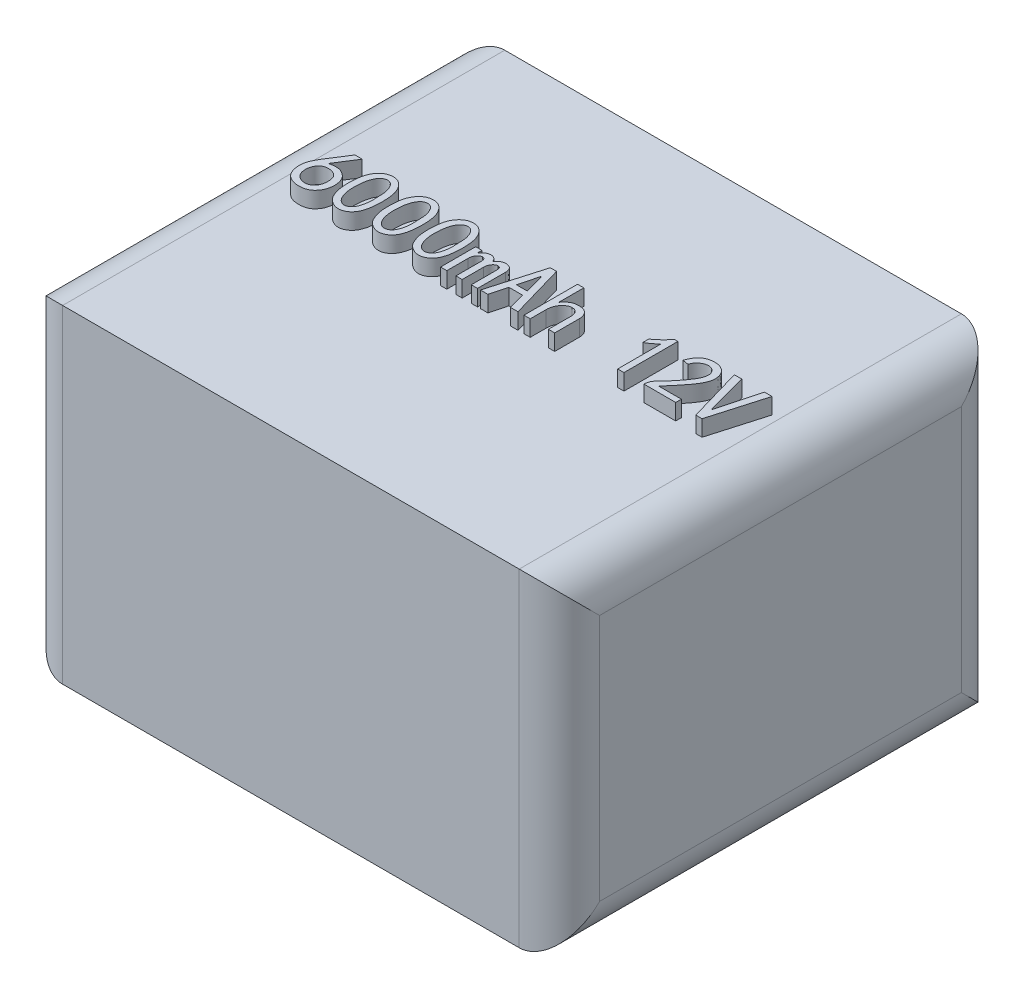
from build123d import *

# Parameters (mm, degrees)
SKETCH_1_W      = 66.8
SKETCH_1_H      = 55
EXTRUDE_1_DEPTH = 40.8
FILLET_1_R      = 5
EXTRUDE_2_DEPTH = 2


with BuildPart() as part:
    # 草图1 → 凸台-拉伸1 (new body)
    with BuildSketch(Plane(origin=(0, 0, 0), x_dir=(1, 0, 0), z_dir=(0, 1, 0))):
        with Locations((33.4, 27.5)):
            Rectangle(SKETCH_1_W, SKETCH_1_H)
    extrude(amount=EXTRUDE_1_DEPTH)

    # 圆角1
    fillet_1_edges = [part.edges().sort_by_distance(p)[0] for p in [
        (66.8, 40.8, -27.5),
        (0, 40.8, -27.5),
        (66.8, 0, -27.5),
        (0, 0, -27.5),
        (0, 20.4, -55),
        (66.8, 20.4, -55),
        (66.8, 20.4, 0),
        (0, 20.4, 0),
    ]]
    fillet(fillet_1_edges, radius=FILLET_1_R)

    # 草图3 → 凸台-拉伸2 (add)
    # profile 1 of 10: a face of its own
    with BuildSketch(Plane(origin=(0, 40.8, 0), x_dir=(1, 0, 0), z_dir=(0, 1, 0))):
        with BuildLine():
            add(Edge.make_bspline(
                [(11.582452743, 29.410355401), (11.586166957, 29.494181149), (11.593411207, 29.657675952), (11.614341343, 29.896069815), (11.639616615, 30.121689523), (11.672477807, 30.333845078), (11.713092583, 30.531830322), (11.759063521, 30.716682862), (11.812190182, 30.887885478), (11.890418071, 31.096974004), (12.007724524, 31.337632365), (12.17551857, 31.602133148), (12.370500827, 31.83990075), (12.554960243, 32.014120852), (12.714899037, 32.136737773), (12.842687085, 32.216348969), (12.976940509, 32.284370743), (13.11809958, 32.339843928), (13.265904721, 32.381166107), (13.419964352, 32.411673837), (13.580786928, 32.430546383), (13.746506674, 32.436161198), (13.913475146, 32.428299435), (14.077497758, 32.402688022), (14.235776716, 32.357221219), (14.388420095, 32.294802478), (14.535012479, 32.214602133), (14.67629178, 32.117264395), (14.81058309, 32.000271989), (14.939560133, 31.868375372), (15.060028466, 31.723212648), (15.170377192, 31.567585354), (15.270147919, 31.403098761), (15.358010789, 31.228850487), (15.436769418, 31.046377026), (15.502840905, 30.854053039), (15.557503666, 30.652659874), (15.617695927, 30.368156703), (15.670652066, 29.990770611), (15.707960335, 29.51314411), (15.71647351, 29.00386048), (15.703797245, 28.563434408), (15.679902191, 28.206587686), (15.652736156, 27.947762316), (15.616247461, 27.702126844), (15.573770277, 27.468485624), (15.52062875, 27.248081167), (15.457655471, 27.040677316), (15.389615667, 26.844919163), (15.309529144, 26.662864424), (15.222302353, 26.492967001), (15.122856353, 26.337403201), (15.015120496, 26.194071783), (14.896238839, 26.064108594), (14.764662525, 25.950131612), (14.624969299, 25.846641024), (14.473407586, 25.75855888), (14.314016088, 25.683812601), (14.149854846, 25.624324089), (13.982973327, 25.585551237), (13.816519664, 25.562506214), (13.649320878, 25.562421907), (13.482367588, 25.576959075), (13.316345433, 25.615199921), (13.149206573, 25.667776944), (12.985427889, 25.742130813), (12.827794772, 25.82774556), (12.679419983, 25.919892751), (12.544358408, 26.02016211), (12.42153089, 26.127241524), (12.309405193, 26.24023194), (12.209304568, 26.360206013), (12.122268009, 26.487495944), (12.025006237, 26.666639588), (11.920807817, 26.897713187), (11.812963032, 27.182340357), (11.724821117, 27.473813879), (11.668144071, 27.724292172), (11.630776974, 27.933836421), (11.61021753, 28.10561054), (11.592358561, 28.290518629), (11.581565112, 28.488603766), (11.574385651, 28.700037692), (11.571261028, 28.924971028), (11.57460539, 29.163377605), (11.579790778, 29.326576014), (11.582452743, 29.410355401)],
                knots=[0, 0, 0, 0, 1.18043416, 2.302333746, 3.366253517, 4.374302266, 5.321670991, 6.208995316, 7.053297808, 7.84229274, 9.348259463, 10.810477328, 12.240076564, 13.663562249, 14.3695339, 15.072606272, 15.778577923, 16.484387009, 17.202829605, 17.934942377, 18.692112664, 19.478485278, 20.265441384, 21.040673806, 21.808439453, 22.577161074, 23.356320991, 24.155029842, 24.986154494, 25.858111265, 26.748121484, 27.637306138, 28.540117759, 29.452135788, 30.380885827, 31.334339875, 32.310628684, 33.31521083, 35.42407972, 37.666773946, 40.052062172, 42.587025658, 43.863776122, 45.083322308, 46.247467896, 47.357025429, 48.423487632, 49.435172604, 50.405897663, 51.337337341, 52.231284254, 53.090220275, 53.931690991, 54.751583713, 55.562922169, 56.377338113, 57.194202079, 58.024663732, 58.851830165, 59.645552351, 60.431282623, 61.21044254, 61.99312915, 62.783838437, 63.60230231, 64.454612977, 65.309477934, 66.125301685, 66.909862715, 67.67340185, 68.415973016, 69.147238889, 69.868837108, 70.581506411, 72.0124375, 73.431838244, 74.861437481, 76.292961888, 77.042577341, 77.855187732, 78.726196438, 79.655959089, 80.645695907, 81.702690171, 82.820655125, 84, 84, 84, 84], degree=3))
        make_face()
        with BuildLine():
            add(Edge.make_bspline(
                [(12.401539305, 29.644380133), (12.392684128, 29.556316156), (12.375239122, 29.382827059), (12.360971218, 29.125459373), (12.356905251, 28.87537721), (12.360628569, 28.632479454), (12.374987458, 28.39724135), (12.399486149, 28.169207664), (12.434383806, 27.948538457), (12.477095455, 27.735818913), (12.528269894, 27.534448947), (12.588958673, 27.347164468), (12.658037112, 27.175329805), (12.734454099, 27.018686114), (12.818336594, 26.877046397), (12.911246582, 26.751214957), (13.010577381, 26.638514934), (13.119297521, 26.543803902), (13.230805841, 26.464267079), (13.344810676, 26.402467713), (13.45945268, 26.358676649), (13.575169416, 26.331900897), (13.691543793, 26.32335157), (13.808622211, 26.331632833), (13.925538636, 26.360536617), (14.041712329, 26.404835723), (14.153810223, 26.465849536), (14.259858752, 26.539524022), (14.357646773, 26.627507132), (14.447225988, 26.728854462), (14.528084162, 26.844192914), (14.602067943, 26.971550667), (14.667031324, 27.113040129), (14.743422668, 27.320205932), (14.820356046, 27.596095278), (14.888801583, 27.940842573), (14.929172439, 28.300369068), (14.939757254, 28.669243147), (14.932875016, 29.035765135), (14.924620637, 29.390823499), (14.904772683, 29.728418911), (14.881018622, 30.050270424), (14.840705762, 30.357815017), (14.76641453, 30.649441858), (14.662354326, 30.925941717), (14.555547801, 31.144210199), (14.453187433, 31.302648539), (14.372494355, 31.408956109), (14.282784238, 31.497788826), (14.188190124, 31.573519249), (14.086511533, 31.631174389), (13.978667996, 31.6743018), (13.864706605, 31.7010282), (13.746354409, 31.714206477), (13.62711863, 31.711902736), (13.510000311, 31.690974622), (13.396407403, 31.65437425), (13.285625158, 31.602269173), (13.179977891, 31.531746383), (13.077776888, 31.445433067), (12.980173521, 31.341875788), (12.88402792, 31.223885099), (12.796326402, 31.086874891), (12.715217994, 30.933397711), (12.643289933, 30.761481611), (12.578870916, 30.572121592), (12.521016428, 30.365327934), (12.472372443, 30.14097623), (12.432006531, 29.898887664), (12.41192654, 29.731149752), (12.401539305, 29.644380133)],
                knots=[0, 0, 0, 0, 1.378198314, 2.715098627, 4.012594964, 5.272602849, 6.497213731, 7.681415101, 8.842769074, 9.975170128, 11.059162755, 12.076494648, 13.038717388, 13.940857576, 14.788360499, 15.598271168, 16.373595835, 17.122768248, 17.838466736, 18.502782022, 19.136468245, 19.744060339, 20.345653328, 20.947246317, 21.563841626, 22.214212994, 22.87852828, 23.546305104, 24.220743313, 24.921956094, 25.648106704, 26.41081768, 27.212668989, 28.069279432, 29.84713992, 31.666334073, 33.537864714, 35.473745168, 37.408579624, 39.246547954, 41.003985019, 42.674193204, 44.272363647, 45.827394737, 47.348405091, 48.867584295, 49.599750274, 50.283750763, 50.94125936, 51.560811542, 52.165388272, 52.754418158, 53.363720025, 53.982318455, 54.604903792, 55.213928724, 55.828148287, 56.458765578, 57.113918044, 57.800421407, 58.537638978, 59.326979919, 60.167286366, 61.066273245, 62.027297208, 63.065989643, 64.179487018, 65.369443928, 66.639232213, 68, 68, 68, 68], degree=3))
        make_face(mode=Mode.SUBTRACT)
    # profile 2 of 10: a face of its own
    with BuildSketch(Plane(origin=(0, 40.8, 0), x_dir=(1, 0, 0), z_dir=(0, 1, 0))):
        with BuildLine():
            add(Edge.make_bspline(
                [(16.574980359, 29.410355401), (16.578694572, 29.494181149), (16.585938822, 29.657675952), (16.606868959, 29.896069815), (16.63214423, 30.121689523), (16.665005422, 30.333845078), (16.705620198, 30.531830322), (16.751591136, 30.716682862), (16.804717797, 30.887885478), (16.882945687, 31.096974004), (17.000252139, 31.337632365), (17.168046186, 31.602133148), (17.363028442, 31.83990075), (17.547487859, 32.014120852), (17.707426652, 32.136737773), (17.8352147, 32.216348969), (17.969468124, 32.284370743), (18.110627196, 32.339843928), (18.258432337, 32.381166107), (18.412491967, 32.411673837), (18.573314544, 32.430546383), (18.73903429, 32.436161198), (18.906002761, 32.428299435), (19.070025374, 32.402688022), (19.228304331, 32.357221219), (19.380947711, 32.294802478), (19.527540094, 32.214602133), (19.668819395, 32.117264395), (19.803110705, 32.000271989), (19.932087748, 31.868375372), (20.052556082, 31.723212648), (20.162904807, 31.567585354), (20.262675535, 31.403098761), (20.350538404, 31.228850487), (20.429297033, 31.046377026), (20.49536852, 30.854053039), (20.550031281, 30.652659874), (20.610223542, 30.368156703), (20.663179682, 29.990770611), (20.70048795, 29.51314411), (20.709001126, 29.00386048), (20.69632486, 28.563434408), (20.672429806, 28.206587686), (20.645263772, 27.947762316), (20.608775076, 27.702126844), (20.566297893, 27.468485624), (20.513156365, 27.248081167), (20.450183086, 27.040677316), (20.382143282, 26.844919163), (20.302056759, 26.662864424), (20.214829968, 26.492967001), (20.115383969, 26.337403201), (20.007648111, 26.194071783), (19.888766455, 26.064108594), (19.757190141, 25.950131612), (19.617496914, 25.846641024), (19.465935201, 25.75855888), (19.306543704, 25.683812601), (19.142382461, 25.624324089), (18.975500942, 25.585551237), (18.80904728, 25.562506214), (18.641848494, 25.562421907), (18.474895203, 25.576959075), (18.308873048, 25.615199921), (18.141734188, 25.667776944), (17.977955504, 25.742130813), (17.820322387, 25.82774556), (17.671947598, 25.919892751), (17.536886023, 26.02016211), (17.414058505, 26.127241524), (17.301932808, 26.24023194), (17.201832183, 26.360206013), (17.114795624, 26.487495944), (17.017533853, 26.666639588), (16.913335433, 26.897713187), (16.805490648, 27.182340357), (16.717348732, 27.473813879), (16.660671687, 27.724292172), (16.623304589, 27.933836421), (16.602745145, 28.10561054), (16.584886176, 28.290518629), (16.574092727, 28.488603766), (16.566913266, 28.700037692), (16.563788644, 28.924971028), (16.567133006, 29.163377605), (16.572318393, 29.326576014), (16.574980359, 29.410355401)],
                knots=[0, 0, 0, 0, 1.18043416, 2.302333746, 3.366253517, 4.374302266, 5.321670991, 6.208995316, 7.053297808, 7.84229274, 9.348259463, 10.810477328, 12.240076564, 13.663562249, 14.3695339, 15.072606272, 15.778577923, 16.484387009, 17.202829605, 17.934942377, 18.692112664, 19.478485278, 20.265441384, 21.040673806, 21.808439453, 22.577161074, 23.356320991, 24.155029842, 24.986154494, 25.858111265, 26.748121484, 27.637306138, 28.540117759, 29.452135788, 30.380885827, 31.334339875, 32.310628684, 33.31521083, 35.42407972, 37.666773946, 40.052062172, 42.587025658, 43.863776122, 45.083322308, 46.247467896, 47.357025429, 48.423487632, 49.435172604, 50.405897663, 51.337337341, 52.231284254, 53.090220275, 53.931690991, 54.751583713, 55.562922169, 56.377338113, 57.194202079, 58.024663732, 58.851830165, 59.645552351, 60.431282623, 61.21044254, 61.99312915, 62.783838437, 63.60230231, 64.454612977, 65.309477934, 66.125301685, 66.909862715, 67.67340185, 68.415973016, 69.147238889, 69.868837108, 70.581506411, 72.0124375, 73.431838244, 74.861437481, 76.292961888, 77.042577341, 77.855187732, 78.726196438, 79.655959089, 80.645695907, 81.702690171, 82.820655125, 84, 84, 84, 84], degree=3))
        make_face()
        with BuildLine():
            add(Edge.make_bspline(
                [(17.39406692, 29.644380133), (17.385211744, 29.556316156), (17.367766737, 29.382827059), (17.353498833, 29.125459373), (17.349432866, 28.87537721), (17.353156185, 28.632479454), (17.367515074, 28.39724135), (17.392013765, 28.169207664), (17.426911422, 27.948538457), (17.469623071, 27.735818913), (17.52079751, 27.534448947), (17.581486289, 27.347164468), (17.650564728, 27.175329805), (17.726981714, 27.018686114), (17.810864209, 26.877046397), (17.903774198, 26.751214957), (18.003104997, 26.638514934), (18.111825136, 26.543803902), (18.223333456, 26.464267079), (18.337338292, 26.402467713), (18.451980295, 26.358676649), (18.567697031, 26.331900897), (18.684071408, 26.32335157), (18.801149827, 26.331632833), (18.918066252, 26.360536617), (19.034239944, 26.404835723), (19.146337838, 26.465849536), (19.252386367, 26.539524022), (19.350174389, 26.627507132), (19.439753603, 26.728854462), (19.520611778, 26.844192914), (19.594595558, 26.971550667), (19.65955894, 27.113040129), (19.735950284, 27.320205932), (19.812883661, 27.596095278), (19.881329199, 27.940842573), (19.921700054, 28.300369068), (19.93228487, 28.669243147), (19.925402631, 29.035765135), (19.917148253, 29.390823499), (19.897300298, 29.728418911), (19.873546237, 30.050270424), (19.833233377, 30.357815017), (19.758942146, 30.649441858), (19.654881941, 30.925941717), (19.548075417, 31.144210199), (19.445715049, 31.302648539), (19.36502197, 31.408956109), (19.275311854, 31.497788826), (19.180717739, 31.573519249), (19.079039148, 31.631174389), (18.971195611, 31.6743018), (18.85723422, 31.7010282), (18.738882024, 31.714206477), (18.619646245, 31.711902736), (18.502527926, 31.690974622), (18.388935018, 31.65437425), (18.278152773, 31.602269173), (18.172505506, 31.531746383), (18.070304503, 31.445433067), (17.972701136, 31.341875788), (17.876555536, 31.223885099), (17.788854017, 31.086874891), (17.70774561, 30.933397711), (17.635817548, 30.761481611), (17.571398531, 30.572121592), (17.513544044, 30.365327934), (17.464900059, 30.14097623), (17.424534146, 29.898887664), (17.404454156, 29.731149752), (17.39406692, 29.644380133)],
                knots=[0, 0, 0, 0, 1.378198314, 2.715098627, 4.012594964, 5.272602849, 6.497213731, 7.681415101, 8.842769074, 9.975170128, 11.059162755, 12.076494648, 13.038717388, 13.940857576, 14.788360499, 15.598271168, 16.373595835, 17.122768248, 17.838466736, 18.502782022, 19.136468245, 19.744060339, 20.345653328, 20.947246317, 21.563841626, 22.214212994, 22.87852828, 23.546305104, 24.220743313, 24.921956094, 25.648106704, 26.41081768, 27.212668989, 28.069279432, 29.84713992, 31.666334073, 33.537864714, 35.473745168, 37.408579624, 39.246547954, 41.003985019, 42.674193204, 44.272363647, 45.827394737, 47.348405091, 48.867584295, 49.599750274, 50.283750763, 50.94125936, 51.560811542, 52.165388272, 52.754418158, 53.363720025, 53.982318455, 54.604903792, 55.213928724, 55.828148287, 56.458765578, 57.113918044, 57.800421407, 58.537638978, 59.326979919, 60.167286366, 61.066273245, 62.027297208, 63.065989643, 64.179487018, 65.369443928, 66.639232213, 68, 68, 68, 68], degree=3))
        make_face(mode=Mode.SUBTRACT)
    # profile 3 of 10: a face of its own
    with BuildSketch(Plane(origin=(0, 40.8, 0), x_dir=(1, 0, 0), z_dir=(0, 1, 0))):
        with BuildLine():
            add(Edge.make_bspline(
                [(21.567507974, 29.410355401), (21.571222188, 29.494181149), (21.578466438, 29.657675952), (21.599396574, 29.896069815), (21.624671845, 30.121689523), (21.657533038, 30.333845078), (21.698147813, 30.531830322), (21.744118752, 30.716682862), (21.797245413, 30.887885478), (21.875473302, 31.096974004), (21.992779754, 31.337632365), (22.160573801, 31.602133148), (22.355556057, 31.83990075), (22.540015474, 32.014120852), (22.699954268, 32.136737773), (22.827742316, 32.216348969), (22.961995739, 32.284370743), (23.103154811, 32.339843928), (23.250959952, 32.381166107), (23.405019582, 32.411673837), (23.565842159, 32.430546383), (23.731561905, 32.436161198), (23.898530377, 32.428299435), (24.062552989, 32.402688022), (24.220831947, 32.357221219), (24.373475326, 32.294802478), (24.520067709, 32.214602133), (24.66134701, 32.117264395), (24.79563832, 32.000271989), (24.924615364, 31.868375372), (25.045083697, 31.723212648), (25.155432423, 31.567585354), (25.25520315, 31.403098761), (25.343066019, 31.228850487), (25.421824648, 31.046377026), (25.487896135, 30.854053039), (25.542558897, 30.652659874), (25.602751157, 30.368156703), (25.655707297, 29.990770611), (25.693015566, 29.51314411), (25.701528741, 29.00386048), (25.688852475, 28.563434408), (25.664957421, 28.206587686), (25.637791387, 27.947762316), (25.601302692, 27.702126844), (25.558825508, 27.468485624), (25.505683981, 27.248081167), (25.442710702, 27.040677316), (25.374670898, 26.844919163), (25.294584375, 26.662864424), (25.207357583, 26.492967001), (25.107911584, 26.337403201), (25.000175726, 26.194071783), (24.88129407, 26.064108594), (24.749717756, 25.950131612), (24.61002453, 25.846641024), (24.458462817, 25.75855888), (24.299071319, 25.683812601), (24.134910077, 25.624324089), (23.968028557, 25.585551237), (23.801574895, 25.562506214), (23.634376109, 25.562421907), (23.467422818, 25.576959075), (23.301400664, 25.615199921), (23.134261804, 25.667776944), (22.97048312, 25.742130813), (22.812850002, 25.82774556), (22.664475214, 25.919892751), (22.529413639, 26.02016211), (22.40658612, 26.127241524), (22.294460423, 26.24023194), (22.194359799, 26.360206013), (22.107323239, 26.487495944), (22.010061468, 26.666639588), (21.905863048, 26.897713187), (21.798018263, 27.182340357), (21.709876348, 27.473813879), (21.653199302, 27.724292172), (21.615832205, 27.933836421), (21.59527276, 28.10561054), (21.577413791, 28.290518629), (21.566620342, 28.488603766), (21.559440881, 28.700037692), (21.556316259, 28.924971028), (21.559660621, 29.163377605), (21.564846008, 29.326576014), (21.567507974, 29.410355401)],
                knots=[0, 0, 0, 0, 1.18043416, 2.302333746, 3.366253517, 4.374302266, 5.321670991, 6.208995316, 7.053297808, 7.84229274, 9.348259463, 10.810477328, 12.240076564, 13.663562249, 14.3695339, 15.072606272, 15.778577923, 16.484387009, 17.202829605, 17.934942377, 18.692112664, 19.478485278, 20.265441384, 21.040673806, 21.808439453, 22.577161074, 23.356320991, 24.155029842, 24.986154494, 25.858111265, 26.748121484, 27.637306138, 28.540117759, 29.452135788, 30.380885827, 31.334339875, 32.310628684, 33.31521083, 35.42407972, 37.666773946, 40.052062172, 42.587025658, 43.863776122, 45.083322308, 46.247467896, 47.357025429, 48.423487632, 49.435172604, 50.405897663, 51.337337341, 52.231284254, 53.090220275, 53.931690991, 54.751583713, 55.562922169, 56.377338113, 57.194202079, 58.024663732, 58.851830165, 59.645552351, 60.431282623, 61.21044254, 61.99312915, 62.783838437, 63.60230231, 64.454612977, 65.309477934, 66.125301685, 66.909862715, 67.67340185, 68.415973016, 69.147238889, 69.868837108, 70.581506411, 72.0124375, 73.431838244, 74.861437481, 76.292961888, 77.042577341, 77.855187732, 78.726196438, 79.655959089, 80.645695907, 81.702690171, 82.820655125, 84, 84, 84, 84], degree=3))
        make_face()
        with BuildLine():
            add(Edge.make_bspline(
                [(22.386594536, 29.644380133), (22.377739359, 29.556316156), (22.360294353, 29.382827059), (22.346026449, 29.125459373), (22.341960482, 28.87537721), (22.3456838, 28.632479454), (22.360042689, 28.39724135), (22.38454138, 28.169207664), (22.419439037, 27.948538457), (22.462150686, 27.735818913), (22.513325125, 27.534448947), (22.574013904, 27.347164468), (22.643092343, 27.175329805), (22.71950933, 27.018686114), (22.803391824, 26.877046397), (22.896301813, 26.751214957), (22.995632612, 26.638514934), (23.104352751, 26.543803902), (23.215861072, 26.464267079), (23.329865907, 26.402467713), (23.444507911, 26.358676649), (23.560224647, 26.331900897), (23.676599024, 26.32335157), (23.793677442, 26.331632833), (23.910593867, 26.360536617), (24.02676756, 26.404835723), (24.138865453, 26.465849536), (24.244913983, 26.539524022), (24.342702004, 26.627507132), (24.432281218, 26.728854462), (24.513139393, 26.844192914), (24.587123173, 26.971550667), (24.652086555, 27.113040129), (24.728477899, 27.320205932), (24.805411277, 27.596095278), (24.873856814, 27.940842573), (24.914227669, 28.300369068), (24.924812485, 28.669243147), (24.917930246, 29.035765135), (24.909675868, 29.390823499), (24.889827913, 29.728418911), (24.866073853, 30.050270424), (24.825760993, 30.357815017), (24.751469761, 30.649441858), (24.647409556, 30.925941717), (24.540603032, 31.144210199), (24.438242664, 31.302648539), (24.357549586, 31.408956109), (24.267839469, 31.497788826), (24.173245355, 31.573519249), (24.071566764, 31.631174389), (23.963723226, 31.6743018), (23.849761835, 31.7010282), (23.731409639, 31.714206477), (23.61217386, 31.711902736), (23.495055542, 31.690974622), (23.381462634, 31.65437425), (23.270680389, 31.602269173), (23.165033121, 31.531746383), (23.062832118, 31.445433067), (22.965228751, 31.341875788), (22.869083151, 31.223885099), (22.781381632, 31.086874891), (22.700273225, 30.933397711), (22.628345164, 30.761481611), (22.563926147, 30.572121592), (22.506071659, 30.365327934), (22.457427674, 30.14097623), (22.417061761, 29.898887664), (22.396981771, 29.731149752), (22.386594536, 29.644380133)],
                knots=[0, 0, 0, 0, 1.378198314, 2.715098627, 4.012594964, 5.272602849, 6.497213731, 7.681415101, 8.842769074, 9.975170128, 11.059162755, 12.076494648, 13.038717388, 13.940857576, 14.788360499, 15.598271168, 16.373595835, 17.122768248, 17.838466736, 18.502782022, 19.136468245, 19.744060339, 20.345653328, 20.947246317, 21.563841626, 22.214212994, 22.87852828, 23.546305104, 24.220743313, 24.921956094, 25.648106704, 26.41081768, 27.212668989, 28.069279432, 29.84713992, 31.666334073, 33.537864714, 35.473745168, 37.408579624, 39.246547954, 41.003985019, 42.674193204, 44.272363647, 45.827394737, 47.348405091, 48.867584295, 49.599750274, 50.283750763, 50.94125936, 51.560811542, 52.165388272, 52.754418158, 53.363720025, 53.982318455, 54.604903792, 55.213928724, 55.828148287, 56.458765578, 57.113918044, 57.800421407, 58.537638978, 59.326979919, 60.167286366, 61.066273245, 62.027297208, 63.065989643, 64.179487018, 65.369443928, 66.639232213, 68, 68, 68, 68], degree=3))
        make_face(mode=Mode.SUBTRACT)
    # profile 4 of 10: a face of its own
    with BuildSketch(Plane(origin=(0, 40.8, 0), x_dir=(1, 0, 0), z_dir=(0, 1, 0))):
        with BuildLine():
            add(Edge.make_bspline(
                [(6.62892925, 27.967202887), (6.636441563, 28.057943651), (6.650987535, 28.23364355), (6.69858255, 28.483934061), (6.75751293, 28.714051224), (6.840650869, 28.927467443), (6.947064026, 29.139826755), (7.06540603, 29.372850516), (7.209789983, 29.628169017), (7.314784779, 29.805408702), (7.370007568, 29.898629224)],
                knots=[0, 0, 0, 0, 1.042998706, 2.019541814, 2.916615498, 3.762308625, 4.638715294, 5.638536551, 6.75797084, 8, 8, 8, 8], degree=3))
            Line((7.370007568, 29.898629224), (8.96917657, 32.394893032))
            Line((8.96917657, 32.394893032), (9.866271375, 32.394893032))
            Line((9.866271375, 32.394893032), (8.228098252, 29.82062098))
            add(Edge.make_bspline(
                [(8.228098252, 29.82062098), (8.313553702, 29.841564003), (8.47861427, 29.882016277), (8.722491257, 29.921252324), (8.952897209, 29.940440336), (9.16990058, 29.940991764), (9.373809893, 29.923041589), (9.564422025, 29.884186203), (9.741999901, 29.824913342), (9.904854661, 29.745946578), (10.053363957, 29.656239862), (10.19005944, 29.563260132), (10.314593964, 29.468403026), (10.426124042, 29.369964842), (10.525672257, 29.268852113), (10.609974919, 29.162687783), (10.685910213, 29.056237357), (10.762630686, 28.90670107), (10.843180348, 28.71480305), (10.913578186, 28.474349878), (10.960261855, 28.224126134), (10.98065355, 27.966685038), (10.980483371, 27.705469297), (10.951723176, 27.444972855), (10.901846583, 27.186363047), (10.824956104, 26.932121649), (10.722265967, 26.6828117), (10.581334347, 26.445803664), (10.406551657, 26.220832354), (10.234870298, 26.047071324), (10.081696716, 25.917135096), (9.951157193, 25.833728716), (9.811188446, 25.75982583), (9.659773657, 25.697600742), (9.497948831, 25.646854081), (9.324605897, 25.610227911), (9.140872224, 25.582356417), (8.948758827, 25.567518223), (8.755293838, 25.562313509), (8.566242453, 25.571918288), (8.384226391, 25.589847713), (8.209428363, 25.62013899), (8.041618502, 25.661928738), (7.882068014, 25.717037016), (7.728852412, 25.782401345), (7.583784556, 25.858450874), (7.447382144, 25.944703296), (7.323497449, 26.042512148), (7.2082574, 26.146079941), (7.105509484, 26.259894351), (7.012313578, 26.381122381), (6.932035103, 26.512013111), (6.859713222, 26.649865221), (6.783539861, 26.844839246), (6.709070798, 27.092096012), (6.649666006, 27.388575078), (6.617470406, 27.680067964), (6.625141483, 27.872289284), (6.62892925, 27.967202887)],
                knots=[0, 0, 0, 0, 1.30987361, 2.530072464, 3.674076933, 4.749737101, 5.758005553, 6.717161001, 7.640113921, 8.538216801, 9.406478839, 10.221965151, 10.999356528, 11.736024514, 12.43585607, 13.108943968, 13.753423114, 14.378993464, 15.606901413, 16.848076322, 18.102664827, 19.390785032, 20.688768111, 21.98673138, 23.287623163, 24.605715361, 25.936233508, 27.292778926, 28.698472844, 30.169013905, 30.922829238, 31.684618084, 32.470496446, 33.277520399, 34.118983406, 34.992471271, 35.913332431, 36.884634966, 37.860137434, 38.793368636, 39.701719614, 40.582389804, 41.432879653, 42.274220425, 43.093418803, 43.911360741, 44.711055379, 45.492833336, 46.259332936, 47.015702139, 47.772988627, 48.533121813, 49.299654956, 50.087983324, 51.646482558, 53.138633408, 54.587135849, 56, 56, 56, 56], degree=3))
        make_face()
        with BuildLine():
            add(Edge.make_bspline(
                [(7.838057032, 26.680066861), (7.867826536, 26.650545451), (7.927577179, 26.591292761), (8.027091567, 26.514127941), (8.133812722, 26.446426519), (8.248030944, 26.390932856), (8.368868862, 26.343283116), (8.497746181, 26.310318436), (8.633044362, 26.282845766), (8.773818223, 26.269873834), (8.915550254, 26.265083799), (9.053391514, 26.27937867), (9.185760455, 26.303909285), (9.311399407, 26.347337617), (9.431480163, 26.40323042), (9.545036052, 26.474600974), (9.65106772, 26.561538459), (9.751985138, 26.660062765), (9.843361493, 26.773349283), (9.923017207, 26.899999882), (9.990896664, 27.038943647), (10.045820611, 27.190065295), (10.087194111, 27.352798843), (10.11739281, 27.527151084), (10.136185163, 27.713961197), (10.141145889, 27.908475718), (10.135285129, 28.101695924), (10.113117925, 28.283847454), (10.073383761, 28.449511744), (10.022419167, 28.600894627), (9.952887587, 28.735531246), (9.867736661, 28.854713738), (9.768010996, 28.958333462), (9.652010351, 29.042933144), (9.528780575, 29.114089228), (9.400950157, 29.173557594), (9.270073926, 29.221665683), (9.135327088, 29.258169459), (8.99595916, 29.28129955), (8.852807227, 29.290902256), (8.706464328, 29.289365104), (8.559060091, 29.276662912), (8.414439472, 29.251974105), (8.278642788, 29.211033749), (8.152194653, 29.158860987), (8.035940669, 29.092712868), (7.931893854, 29.010455346), (7.836308495, 28.917374461), (7.752575637, 28.809528315), (7.655813418, 28.649963045), (7.560056062, 28.43662439), (7.480285636, 28.169449456), (7.441353119, 27.894408789), (7.441809451, 27.66230323), (7.460332113, 27.479115316), (7.484864701, 27.346666653), (7.519954475, 27.220806274), (7.562958781, 27.100137929), (7.616690127, 26.98551826), (7.680612838, 26.876809276), (7.753825994, 26.7739901), (7.81000274, 26.711349272), (7.838057032, 26.680066861)],
                knots=[0, 0, 0, 0, 0.824379014, 1.654618615, 2.472217002, 3.307040171, 4.149944448, 5.023399345, 5.920986251, 6.863846236, 7.802124107, 8.706338671, 9.585327007, 10.445314643, 11.314286422, 12.187124327, 13.076521263, 14.007883694, 14.9579535, 15.93325223, 16.946080417, 17.995267438, 19.091535754, 20.245890406, 21.474436714, 22.782621587, 24.072176649, 25.275692408, 26.385796877, 27.419682211, 28.411368294, 29.355370333, 30.293504652, 31.227802789, 32.170424673, 33.090341057, 33.998667172, 34.911184711, 35.833391934, 36.773820451, 37.730905064, 38.710612777, 39.6827302, 40.612114241, 41.495534864, 42.369965774, 43.234275376, 44.098636918, 44.989546864, 45.912629924, 47.765713501, 49.573670898, 51.382745352, 53.211540175, 54.12612168, 55.003320594, 55.858492095, 56.694765964, 57.521374723, 58.34531796, 59.173662839, 60, 60, 60, 60], degree=3))
        make_face(mode=Mode.SUBTRACT)
    # profile 5 of 10: a face of its own
    with BuildSketch(Plane(origin=(0, 40.8, 0), x_dir=(1, 0, 0), z_dir=(0, 1, 0))):
        with BuildLine():
            Line((30.967501375, 25.647179927), (30.187418935, 25.647179927))
            Line((30.187418935, 25.647179927), (30.187418935, 28.806513808))
            add(Edge.make_bspline(
                [(30.187418935, 28.806513808), (30.186765559, 28.844120179), (30.185512019, 28.916270311), (30.171103668, 29.019577344), (30.146528735, 29.112769722), (30.113259661, 29.196332239), (30.063831555, 29.267843244), (29.991773376, 29.31922202), (29.899994175, 29.347483624), (29.833211929, 29.350794797), (29.797377715, 29.352571516)],
                knots=[0, 0, 0, 0, 1.172990478, 2.250454306, 3.245547364, 4.174930135, 5.046638938, 5.918347741, 6.883020922, 8, 8, 8, 8], degree=3))
            add(Edge.make_bspline(
                [(29.797377715, 29.352571516), (29.752021073, 29.34882655), (29.659922169, 29.34122221), (29.527403324, 29.280865253), (29.40137426, 29.186876), (29.284038299, 29.059127265), (29.181275527, 28.903752032), (29.109085749, 28.720796259), (29.063310236, 28.517443597), (29.058692866, 28.373878766), (29.056299397, 28.299460222)],
                knots=[0, 0, 0, 0, 0.766913604, 1.557256011, 2.427911044, 3.421802423, 4.484200412, 5.568564768, 6.739636535, 8, 8, 8, 8], degree=3))
            Line((29.056299397, 28.299460222), (29.056299397, 25.647179927))
            Line((29.056299397, 25.647179927), (28.276216957, 25.647179927))
            Line((28.276216957, 25.647179927), (28.276216957, 28.806513808))
            add(Edge.make_bspline(
                [(28.276216957, 28.806513808), (28.275563582, 28.844120179), (28.274310041, 28.916270311), (28.25990169, 29.019577344), (28.235326757, 29.112769722), (28.202057684, 29.196332239), (28.152629577, 29.267843244), (28.080571398, 29.31922202), (27.988792198, 29.347483624), (27.922009951, 29.350794797), (27.886175737, 29.352571516)],
                knots=[0, 0, 0, 0, 1.172990478, 2.250454306, 3.245547364, 4.174930135, 5.046638938, 5.918347741, 6.883020922, 8, 8, 8, 8], degree=3))
            add(Edge.make_bspline(
                [(27.886175737, 29.352571516), (27.840819096, 29.34882655), (27.748720192, 29.34122221), (27.616201347, 29.280865253), (27.490172282, 29.186876), (27.372836321, 29.059127265), (27.270073549, 28.903752032), (27.197883771, 28.720796259), (27.152108258, 28.517443597), (27.147490888, 28.373878766), (27.145097419, 28.299460222)],
                knots=[0, 0, 0, 0, 0.766913604, 1.557256011, 2.427911044, 3.421802423, 4.484200412, 5.568564768, 6.739636535, 8, 8, 8, 8], degree=3))
            Line((27.145097419, 28.299460222), (27.145097419, 25.647179927))
            Line((27.145097419, 25.647179927), (26.365014979, 25.647179927))
            Line((26.365014979, 25.647179927), (26.365014979, 30.01564159))
            Line((26.365014979, 30.01564159), (27.145097419, 30.01564159))
            Line((27.145097419, 30.01564159), (27.145097419, 29.43057976))
            add(Edge.make_bspline(
                [(27.145097419, 29.43057976), (27.178164455, 29.480538569), (27.242919918, 29.578373335), (27.357377627, 29.708277355), (27.478121937, 29.824110096), (27.610358711, 29.919384278), (27.749356457, 29.996466433), (27.894038143, 30.054223364), (28.045139571, 30.086226792), (28.147028686, 30.091167874), (28.198208713, 30.093649834)],
                knots=[0, 0, 0, 0, 1.105035383, 2.164000341, 3.189319476, 4.188868779, 5.163914028, 6.118307184, 7.054804926, 8, 8, 8, 8], degree=3))
            add(Edge.make_bspline(
                [(28.198208713, 30.093649834), (28.248439929, 30.091303428), (28.345630992, 30.086763429), (28.486224516, 30.05517658), (28.612947584, 29.997666526), (28.726624229, 29.919827337), (28.827980066, 29.824817032), (28.908195845, 29.707939962), (28.975314379, 29.576705252), (29.003009258, 29.480305978), (29.017295275, 29.43057976)],
                knots=[0, 0, 0, 0, 1.054125019, 2.039598852, 3.00311637, 3.956135942, 4.921083366, 5.899693326, 6.916586166, 8, 8, 8, 8], degree=3))
            add(Edge.make_bspline(
                [(29.017295275, 29.43057976), (29.050028308, 29.480405634), (29.113759789, 29.577417015), (29.223491678, 29.707875789), (29.338398561, 29.82293305), (29.462236251, 29.9197266), (29.594010192, 29.996193292), (29.732634382, 30.054961888), (29.880268991, 30.08621425), (29.980713988, 30.091156023), (30.031402447, 30.093649834)],
                knots=[0, 0, 0, 0, 1.127724244, 2.195688248, 3.220611048, 4.201621127, 5.161610027, 6.097757614, 7.040054382, 8, 8, 8, 8], degree=3))
            add(Edge.make_bspline(
                [(30.031402447, 30.093649834), (30.104883796, 30.090980613), (30.243970255, 30.085928277), (30.438355872, 30.038335122), (30.604150204, 29.958152549), (30.738983529, 29.843747748), (30.842934462, 29.700046894), (30.91745597, 29.52981864), (30.960337386, 29.332514665), (30.965027269, 29.192441263), (30.967501375, 29.118546784)],
                knots=[0, 0, 0, 0, 1.141342915, 2.160348787, 3.088109297, 3.980870533, 4.881139354, 5.823297628, 6.851700002, 8, 8, 8, 8], degree=3))
            Line((30.967501375, 29.118546784), (30.967501375, 25.647179927))
        make_face()
    # profile 6 of 10: a face of its own
    with BuildSketch(Plane(origin=(0, 40.8, 0), x_dir=(1, 0, 0), z_dir=(0, 1, 0))):
        Polygon((35.999033112, 25.647179927), (35.062934184, 25.647179927), (34.516876476, 27.714398393), (32.800695108, 27.714398393), (32.2546374, 25.647179927), (31.318538473, 25.647179927), (33.268744572, 32.394893032), (34.048827012, 32.394893032), align=None)
        Polygon((34.321855866, 28.45547671), (33.697789914, 30.834728152), (33.61978167, 30.834728152), (32.995715718, 28.45547671), align=None, mode=Mode.SUBTRACT)
    # profile 7 of 10: a face of its own
    with BuildSketch(Plane(origin=(0, 40.8, 0), x_dir=(1, 0, 0), z_dir=(0, 1, 0))):
        with BuildLine():
            Line((40.562515385, 25.647179927), (39.782432945, 25.647179927))
            Line((39.782432945, 25.647179927), (39.782432945, 28.45547671))
            add(Edge.make_bspline(
                [(39.782432945, 28.45547671), (39.779973222, 28.529865065), (39.775293728, 28.671384964), (39.731600177, 28.872111658), (39.657792548, 29.048538544), (39.554429126, 29.199019829), (39.426859575, 29.320637977), (39.276716453, 29.408469369), (39.106305714, 29.460202088), (38.986339478, 29.466387388), (38.924342262, 29.469583882)],
                knots=[0, 0, 0, 0, 1.191937445, 2.267597745, 3.274659925, 4.240880371, 5.175179059, 6.078607681, 7.007045828, 8, 8, 8, 8], degree=3))
            add(Edge.make_bspline(
                [(38.924342262, 29.469583882), (38.882326525, 29.467821798), (38.798074639, 29.464288384), (38.672937978, 29.438392167), (38.549337336, 29.398274129), (38.428270695, 29.339314851), (38.310265269, 29.26317327), (38.192099349, 29.173197006), (38.076537512, 29.065786423), (37.965675168, 28.942450575), (37.86075518, 28.808806085), (37.769003096, 28.664790395), (37.69242851, 28.512695719), (37.630009652, 28.352455992), (37.581317164, 28.184627113), (37.544275406, 28.009033304), (37.524716429, 27.825116624), (37.521718025, 27.699993185), (37.52019387, 27.636390149)],
                knots=[0, 0, 0, 0, 0.794110233, 1.592386319, 2.407316365, 3.246311514, 4.130492091, 5.059356292, 6.0517095, 7.108955691, 8.19273155, 9.261289681, 10.332328148, 11.407809094, 12.508552303, 13.633659266, 14.797136201, 16, 16, 16, 16], degree=3))
            Line((37.52019387, 27.636390149), (37.52019387, 25.647179927))
            Line((37.52019387, 25.647179927), (36.74011143, 25.647179927))
            Line((36.74011143, 25.647179927), (36.74011143, 32.316884788))
            Line((36.74011143, 32.316884788), (37.52019387, 32.316884788))
            Line((37.52019387, 32.316884788), (37.52019387, 29.196555028))
            add(Edge.make_bspline(
                [(37.52019387, 29.196555028), (37.572522584, 29.264891535), (37.6741697, 29.397633354), (37.841726664, 29.57686202), (38.016077242, 29.731476716), (38.199736621, 29.864818267), (38.402936486, 29.969784681), (38.631651768, 30.04314631), (38.886604593, 30.086181141), (39.065257193, 30.09109095), (39.158366993, 30.093649834)],
                knots=[0, 0, 0, 0, 1.057067424, 2.053324943, 3.00898071, 3.91684935, 4.835050369, 5.806094702, 6.856584871, 8, 8, 8, 8], degree=3))
            add(Edge.make_bspline(
                [(39.158366993, 30.093649834), (39.215247234, 30.092752038), (39.325489786, 30.091011973), (39.48492804, 30.071617593), (39.633379856, 30.041536143), (39.771592127, 29.999851631), (39.899192027, 29.945634218), (40.014417946, 29.876423461), (40.119202758, 29.796600224), (40.213442861, 29.705536545), (40.294591107, 29.604437834), (40.366517067, 29.497845246), (40.427763702, 29.384911851), (40.475917831, 29.264769033), (40.51605691, 29.139515781), (40.542984794, 29.007788069), (40.558972512, 28.869991238), (40.561320575, 28.776220636), (40.562515385, 28.728505564)],
                knots=[0, 0, 0, 0, 1.230277741, 2.384465232, 3.469607194, 4.504611926, 5.503420526, 6.461276328, 7.405373958, 8.348608637, 9.289249711, 10.205389039, 11.128494408, 12.063113834, 13.002368724, 13.971045551, 14.96756867, 16, 16, 16, 16], degree=3))
            Line((40.562515385, 28.728505564), (40.562515385, 25.647179927))
        make_face()
    # profile 8 of 10: a face of its own
    with BuildSketch(Plane(origin=(0, 40.8, 0), x_dir=(1, 0, 0), z_dir=(0, 1, 0))):
        with BuildLine():
            add(Edge.make_bspline(
                [(48.363339784, 31.068752884), (48.274539956, 30.983557757), (48.091540614, 30.807987012), (47.783732666, 30.56403345), (47.444468852, 30.322075442), (47.201335153, 30.171265702), (47.076203758, 30.093649834)],
                knots=[0, 0, 0, 0, 0.911926792, 1.879305458, 2.908561558, 4, 4, 4, 4], degree=3))
            Line((47.076203758, 30.093649834), (47.076203758, 30.834728152))
            add(Edge.make_bspline(
                [(47.076203758, 30.834728152), (47.156290234, 30.890209344), (47.315343534, 31.000396073), (47.541048843, 31.179613911), (47.759261443, 31.362096056), (47.963382654, 31.555295969), (48.159903555, 31.752627424), (48.342314826, 31.959620425), (48.51603047, 32.172301326), (48.622213509, 32.320632719), (48.67537276, 32.394893032)],
                knots=[0, 0, 0, 0, 1.040526584, 2.066506081, 3.077559129, 4.07840537, 5.067830316, 6.05167646, 7.024595449, 8, 8, 8, 8], degree=3))
            Line((48.67537276, 32.394893032), (49.143422224, 32.394893032))
            Line((49.143422224, 32.394893032), (49.143422224, 25.686184049))
            Line((49.143422224, 25.686184049), (48.363339784, 25.686184049))
            Line((48.363339784, 25.686184049), (48.363339784, 31.068752884))
        make_face()
    # profile 9 of 10: a face of its own
    with BuildSketch(Plane(origin=(0, 40.8, 0), x_dir=(1, 0, 0), z_dir=(0, 1, 0))):
        with BuildLine():
            add(Edge.make_bspline(
                [(51.639686032, 25.842200537), (51.644404282, 25.890513799), (51.653782043, 25.986538856), (51.686711254, 26.127804244), (51.733045073, 26.265729342), (51.794002483, 26.400252313), (51.869269253, 26.53142768), (51.961849244, 26.656478177), (52.065231137, 26.78091537), (52.188866906, 26.898530066), (52.32217373, 27.023672268), (52.460250937, 27.166913091), (52.609807718, 27.323297362), (52.764784196, 27.499489618), (52.931723861, 27.689153874), (53.1042053, 27.897894035), (53.286348067, 28.121717721), (53.473040709, 28.356463423), (53.655993074, 28.592236668), (53.824588731, 28.820736099), (53.977912864, 29.034091408), (54.114728119, 29.23305583), (54.231388898, 29.419921482), (54.33269755, 29.591788559), (54.419140706, 29.748346277), (54.505402584, 29.935328302), (54.586816599, 30.150967747), (54.65065394, 30.395940462), (54.679662587, 30.622659388), (54.668258606, 30.830998897), (54.623476198, 31.021123422), (54.545233625, 31.193610819), (54.435431986, 31.349073761), (54.29505049, 31.48170037), (54.13503259, 31.590891522), (53.956960808, 31.664256443), (53.766425684, 31.701333286), (53.567090738, 31.697978813), (53.366168486, 31.662257312), (53.166006993, 31.600166962), (52.973049313, 31.504027697), (52.784012899, 31.384090368), (52.608868902, 31.229574836), (52.454926953, 31.039295304), (52.323971154, 30.814221093), (52.258636981, 30.6479466), (52.224747862, 30.561699298)],
                knots=[0, 0, 0, 0, 0.683264685, 1.358023177, 2.0380809, 2.730345762, 3.435487858, 4.164189287, 4.919895072, 5.711413948, 6.565494804, 7.49616148, 8.513531843, 9.613812574, 10.80147361, 12.073102873, 13.428218159, 14.866997124, 16.298560904, 17.632315587, 18.867297526, 20.000038836, 21.033387935, 21.969994494, 22.810824564, 23.551397478, 24.869445784, 26.052467085, 27.111050094, 28.075902372, 28.975949733, 29.847314516, 30.728213316, 31.639844513, 32.554273251, 33.442456201, 34.333871785, 35.270085163, 36.233696473, 37.201335111, 38.211692251, 39.261697588, 40.347896805, 41.485826765, 42.695887429, 44, 44, 44, 44], degree=3))
            Line((52.224747862, 30.561699298), (51.483669544, 30.678711664))
            add(Edge.make_bspline(
                [(51.483669544, 30.678711664), (51.50983413, 30.751255526), (51.560739047, 30.892394365), (51.648395533, 31.093369238), (51.738946746, 31.280450718), (51.834878142, 31.45239923), (51.938270904, 31.607987405), (52.046617277, 31.74872787), (52.160400029, 31.874601767), (52.280056603, 31.985461863), (52.405176087, 32.083190425), (52.536617709, 32.16794378), (52.672744815, 32.241978104), (52.814092882, 32.30480995), (52.960967135, 32.355446245), (53.114020625, 32.392269621), (53.271687898, 32.420837191), (53.379350326, 32.429506572), (53.433875644, 32.433897154)],
                knots=[0, 0, 0, 0, 1.318688324, 2.565594597, 3.747971738, 4.872722892, 5.930337296, 6.940181326, 7.908044283, 8.828858542, 9.726735078, 10.619953387, 11.500744836, 12.374616489, 13.262770363, 14.15366946, 15.064931369, 16, 16, 16, 16], degree=3))
            add(Edge.make_bspline(
                [(53.433875644, 32.433897154), (53.497392785, 32.438991462), (53.620921333, 32.448898906), (53.801976349, 32.450764327), (53.972842615, 32.438947042), (54.136543378, 32.416503879), (54.296470512, 32.37682957), (54.45674383, 32.318287168), (54.618879036, 32.239160617), (54.782612449, 32.142110978), (54.943109572, 32.023308291), (55.088414727, 31.873920356), (55.21664052, 31.696839475), (55.331207022, 31.496517972), (55.423680731, 31.271296125), (55.479294403, 31.020432987), (55.499687895, 30.748306102), (55.488482243, 30.508271992), (55.461185979, 30.305157851), (55.42294093, 30.142825304), (55.367823356, 29.973836787), (55.302928492, 29.795574918), (55.216755177, 29.612267039), (55.1197609, 29.419978303), (55.003771075, 29.22219488), (54.898511155, 29.05131982), (54.803144517, 28.909046909), (54.723266629, 28.792951201), (54.636004498, 28.669024415), (54.538060003, 28.539236959), (54.434618226, 28.400612978), (54.323348555, 28.254349948), (54.203282475, 28.101715909), (54.075808825, 27.940776338), (53.940352022, 27.771960427), (53.796300706, 27.59624648), (53.643694667, 27.41402965), (53.484908663, 27.222840729), (53.318009199, 27.024282208), (53.142868461, 26.818541174), (52.958908028, 26.606544722), (52.83432462, 26.461969933), (52.77080557, 26.388258245)],
                knots=[0, 0, 0, 0, 0.924262298, 1.797511285, 2.623724224, 3.407158757, 4.191620419, 5.009283641, 5.877881841, 6.805175164, 7.767818098, 8.765683208, 9.814991193, 10.931884262, 12.107176208, 13.332417047, 14.642951659, 16.055476784, 16.810263112, 17.613474593, 18.470705512, 19.388078144, 20.363412498, 21.406914204, 22.511682051, 23.688322701, 24.318011351, 24.996206783, 25.732766533, 26.516574724, 27.354866926, 28.242087009, 29.182574856, 30.172115786, 31.220563025, 32.322544456, 33.468316952, 34.668650042, 35.928027342, 37.231299145, 38.588373428, 40, 40, 40, 40], degree=3))
            Line((52.77080557, 26.388258245), (55.579102353, 26.388258245))
            Line((55.579102353, 26.388258245), (55.579102353, 25.686184049))
            Line((55.579102353, 25.686184049), (51.639686032, 25.686184049))
            Line((51.639686032, 25.686184049), (51.639686032, 25.842200537))
        make_face()
    # profile 10 of 10: a face of its own
    with BuildSketch(Plane(origin=(0, 40.8, 0), x_dir=(1, 0, 0), z_dir=(0, 1, 0))):
        Polygon((60.922667067, 32.316884788), (58.972460967, 25.569171683), (58.192378527, 25.569171683), (56.242172427, 32.316884788), (57.178271355, 32.316884788), (58.543415625, 27.207344807), (58.621423869, 27.207344807), (59.986568139, 32.316884788), align=None)
    extrude(amount=EXTRUDE_2_DEPTH)


solid = part.part
